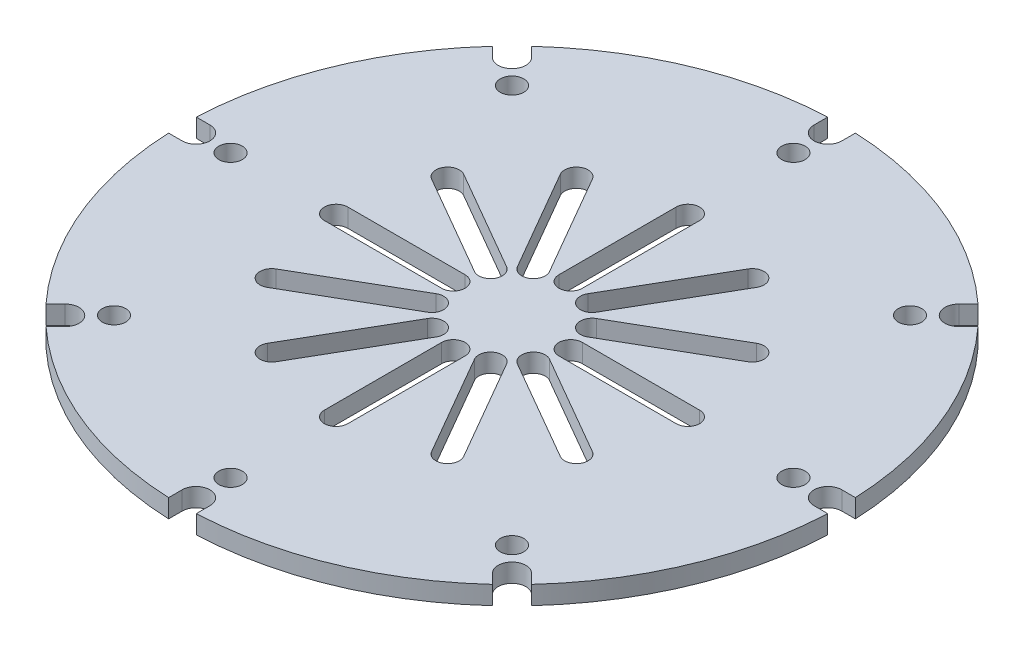
from build123d import *

# Parameters (mm, degrees)
SKETCH1_R           = 14.2875
SKETCH1_R_2         = 0.508
BOSS_EXTRUDE1_DEPTH = 0.8
CUT_EXTRUDE1_START  = -0.8
CUT_EXTRUDE1_DEPTH  = 0.8
CUT_EXTRUDE2_DEPTH  = 21.203596524


with BuildPart() as part:
    # Sketch1 → Boss-Extrude1 (new body)
    with BuildSketch(Plane(origin=(0, 0, 0), x_dir=(1, 0, 0), z_dir=(0, 1, 0))):
        with Locations(Location((0, 0, 0), (0, 0, 270))):
            Circle(SKETCH1_R)
        with Locations(Location((0, 12.192, 0), (0, 0, 270))):
            Circle(SKETCH1_R_2, mode=Mode.SUBTRACT)
        with Locations(Location((8.621045876, 8.621045876, 0), (0, 0, 270))):
            Circle(SKETCH1_R_2, mode=Mode.SUBTRACT)
        with Locations(Location((12.192, 0, 0), (0, 0, 270))):
            Circle(SKETCH1_R_2, mode=Mode.SUBTRACT)
        with Locations(Location((8.621045876, -8.621045876, 0), (0, 0, 270))):
            Circle(SKETCH1_R_2, mode=Mode.SUBTRACT)
        with Locations(Location((0, -12.192, 0), (0, 0, 270))):
            Circle(SKETCH1_R_2, mode=Mode.SUBTRACT)
        with Locations(Location((-8.621045876, -8.621045876, 0), (0, 0, 270))):
            Circle(SKETCH1_R_2, mode=Mode.SUBTRACT)
        with Locations(Location((-12.192, 0, 0), (0, 0, 270))):
            Circle(SKETCH1_R_2, mode=Mode.SUBTRACT)
        with Locations(Location((-8.621045876, 8.621045876, 0), (0, 0, 270))):
            Circle(SKETCH1_R_2, mode=Mode.SUBTRACT)
    extrude(amount=BOSS_EXTRUDE1_DEPTH)

    # Sketch2 → Cut-Extrude1 (cut)
    with BuildSketch(Plane(origin=(0, 0.8, 0), x_dir=(1, 0, 0), z_dir=(0, 1, 0)).offset(CUT_EXTRUDE1_START)):
        with BuildLine():
            ThreePointArc((10.518139842, 9.669611704), (10.102788136, 10.102788136), (9.669611704, 10.518139842))
            Line((9.669611704, 10.518139842), (9.254259999, 10.102788136))
            ThreePointArc((9.254259999, 10.102788136), (9.254259999, 9.254259999), (10.102788136, 9.254259999))
            Line((10.102788136, 9.254259999), (10.518139842, 9.669611704))
        make_face()
        with BuildLine():
            ThreePointArc((14.2875, 0), (14.284348656, 0.300066185), (14.274896015, 0.6))
            Line((14.274896015, 0.6), (13.6875, 0.6))
            ThreePointArc((13.6875, 0.6), (13.0875, 0), (13.6875, -0.6))
            Line((13.6875, -0.6), (14.274896015, -0.6))
            ThreePointArc((14.274896015, -0.6), (14.284348656, -0.300066185), (14.2875, 0))
        make_face()
        with BuildLine():
            ThreePointArc((0.6, 14.274896015), (0, 14.2875), (-0.6, 14.274896015))
            Line((-0.6, 14.274896015), (-0.6, 13.6875))
            ThreePointArc((-0.6, 13.6875), (0, 13.0875), (0.6, 13.6875))
            Line((0.6, 13.6875), (0.6, 14.274896015))
        make_face()
        with BuildLine():
            ThreePointArc((9.669611704, -10.518139842), (10.102788136, -10.102788136), (10.518139842, -9.669611704))
            Line((10.518139842, -9.669611704), (10.102788136, -9.254259999))
            ThreePointArc((10.102788136, -9.254259999), (9.254259999, -9.254259999), (9.254259999, -10.102788136))
            Line((9.254259999, -10.102788136), (9.669611704, -10.518139842))
        make_face()
        with BuildLine():
            Line((-0.6, -13.6875), (-0.6, -14.274896015))
            ThreePointArc((-0.6, -14.274896015), (0, -14.2875), (0.6, -14.274896015))
            Line((0.6, -14.274896015), (0.6, -13.6875))
            ThreePointArc((0.6, -13.6875), (0, -13.0875), (-0.6, -13.6875))
        make_face()
        with BuildLine():
            Line((-10.102788136, -9.254259999), (-10.518139842, -9.669611704))
            ThreePointArc((-10.518139842, -9.669611704), (-10.102788136, -10.102788136), (-9.669611704, -10.518139842))
            Line((-9.669611704, -10.518139842), (-9.254259999, -10.102788136))
            ThreePointArc((-9.254259999, -10.102788136), (-9.254259999, -9.254259999), (-10.102788136, -9.254259999))
        make_face()
        with BuildLine():
            Line((-13.6875, 0.6), (-14.274896015, 0.6))
            ThreePointArc((-14.274896015, 0.6), (-14.2875, 0), (-14.274896015, -0.6))
            Line((-14.274896015, -0.6), (-13.6875, -0.6))
            ThreePointArc((-13.6875, -0.6), (-13.0875, 0), (-13.6875, 0.6))
        make_face()
        with BuildLine():
            Line((-9.254259999, 10.102788136), (-9.669611704, 10.518139842))
            ThreePointArc((-9.669611704, 10.518139842), (-10.102788136, 10.102788136), (-10.518139842, 9.669611704))
            Line((-10.518139842, 9.669611704), (-10.102788136, 9.254259999))
            ThreePointArc((-10.102788136, 9.254259999), (-9.254259999, 9.254259999), (-9.254259999, 10.102788136))
        make_face()
    extrude(amount=CUT_EXTRUDE1_DEPTH, mode=Mode.SUBTRACT)

    # Sketch3 → Cut-Extrude2 (cut, through all)
    with BuildSketch(Plane(origin=(0, 0.8, 0), x_dir=(1, 0, 0), z_dir=(0, 1, 0))):
        with BuildLine():
            Line((-0.508, 2.54), (-0.508, 7.62))
            ThreePointArc((-0.508, 7.62), (0, 8.128), (0.508, 7.62))
            Line((0.508, 7.62), (0.508, 2.54))
            ThreePointArc((0.508, 2.54), (0, 2.032), (-0.508, 2.54))
        make_face()
        with BuildLine():
            Line((0.830059095, 2.453704526), (3.370059095, 6.853113577))
            ThreePointArc((3.370059095, 6.853113577), (4.064, 7.039054482), (4.249940905, 6.345113577))
            Line((4.249940905, 6.345113577), (1.709940905, 1.945704526))
            ThreePointArc((1.709940905, 1.945704526), (1.016, 1.75976362), (0.830059095, 2.453704526))
        make_face()
        with BuildLine():
            Line((1.945704526, 1.709940905), (6.345113577, 4.249940905))
            ThreePointArc((6.345113577, 4.249940905), (7.039054482, 4.064), (6.853113577, 3.370059095))
            Line((6.853113577, 3.370059095), (2.453704526, 0.830059095))
            ThreePointArc((2.453704526, 0.830059095), (1.75976362, 1.016), (1.945704526, 1.709940905))
        make_face()
        with BuildLine():
            Line((2.54, 0.508), (7.62, 0.508))
            ThreePointArc((7.62, 0.508), (8.128, 0), (7.62, -0.508))
            Line((7.62, -0.508), (2.54, -0.508))
            ThreePointArc((2.54, -0.508), (2.032, 0), (2.54, 0.508))
        make_face()
        with BuildLine():
            Line((2.453704526, -0.830059095), (6.853113577, -3.370059095))
            ThreePointArc((6.853113577, -3.370059095), (7.039054482, -4.064), (6.345113577, -4.249940905))
            Line((6.345113577, -4.249940905), (1.945704526, -1.709940905))
            ThreePointArc((1.945704526, -1.709940905), (1.75976362, -1.016), (2.453704526, -0.830059095))
        make_face()
        with BuildLine():
            Line((1.709940905, -1.945704526), (4.249940905, -6.345113577))
            ThreePointArc((4.249940905, -6.345113577), (4.064, -7.039054482), (3.370059095, -6.853113577))
            Line((3.370059095, -6.853113577), (0.830059095, -2.453704526))
            ThreePointArc((0.830059095, -2.453704526), (1.016, -1.75976362), (1.709940905, -1.945704526))
        make_face()
        with BuildLine():
            Line((0.508, -2.54), (0.508, -7.62))
            ThreePointArc((0.508, -7.62), (0, -8.128), (-0.508, -7.62))
            Line((-0.508, -7.62), (-0.508, -2.54))
            ThreePointArc((-0.508, -2.54), (0, -2.032), (0.508, -2.54))
        make_face()
        with BuildLine():
            Line((-0.830059095, -2.453704526), (-3.370059095, -6.853113577))
            ThreePointArc((-3.370059095, -6.853113577), (-4.064, -7.039054482), (-4.249940905, -6.345113577))
            Line((-4.249940905, -6.345113577), (-1.709940905, -1.945704526))
            ThreePointArc((-1.709940905, -1.945704526), (-1.016, -1.75976362), (-0.830059095, -2.453704526))
        make_face()
        with BuildLine():
            Line((-1.945704526, -1.709940905), (-6.345113577, -4.249940905))
            ThreePointArc((-6.345113577, -4.249940905), (-7.039054482, -4.064), (-6.853113577, -3.370059095))
            Line((-6.853113577, -3.370059095), (-2.453704526, -0.830059095))
            ThreePointArc((-2.453704526, -0.830059095), (-1.75976362, -1.016), (-1.945704526, -1.709940905))
        make_face()
        with BuildLine():
            Line((-2.54, -0.508), (-7.62, -0.508))
            ThreePointArc((-7.62, -0.508), (-8.128, 0), (-7.62, 0.508))
            Line((-7.62, 0.508), (-2.54, 0.508))
            ThreePointArc((-2.54, 0.508), (-2.032, 0), (-2.54, -0.508))
        make_face()
        with BuildLine():
            Line((-2.453704526, 0.830059095), (-6.853113577, 3.370059095))
            ThreePointArc((-6.853113577, 3.370059095), (-7.039054482, 4.064), (-6.345113577, 4.249940905))
            Line((-6.345113577, 4.249940905), (-1.945704526, 1.709940905))
            ThreePointArc((-1.945704526, 1.709940905), (-1.75976362, 1.016), (-2.453704526, 0.830059095))
        make_face()
        with BuildLine():
            Line((-1.709940905, 1.945704526), (-4.249940905, 6.345113577))
            ThreePointArc((-4.249940905, 6.345113577), (-4.064, 7.039054482), (-3.370059095, 6.853113577))
            Line((-3.370059095, 6.853113577), (-0.830059095, 2.453704526))
            ThreePointArc((-0.830059095, 2.453704526), (-1.016, 1.75976362), (-1.709940905, 1.945704526))
        make_face()
    extrude(amount=-CUT_EXTRUDE2_DEPTH, mode=Mode.SUBTRACT)


solid = part.part
